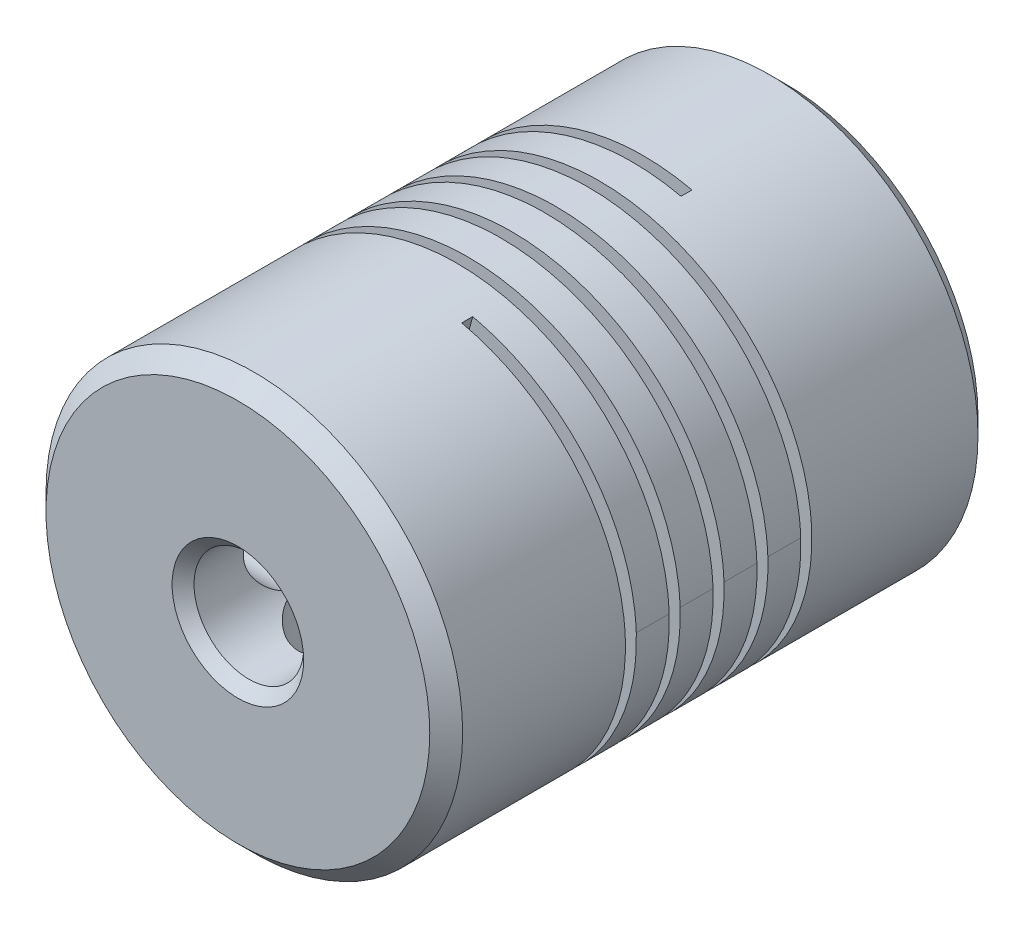
from build123d import *

# Parameters (mm, degrees)
SKETCH_1_R           = 9.5
BODY_DEPTH           = 25
SKETCH_2_R           = 2.5
RODHOLE_DEPTH        = 42
OUTERCHAMFER_SIZE    = 0.75
INNERCHAMFER_SIZE    = 0.5
SKETCH_3_R           = 1.75
SETSCREWHOLES1_DEPTH = 12
SKETCH_4_R           = 1.75
SETSCREWHOLES2_DEPTH = 12
SLOT_PITCH           = 2
SLOT_HEIGHT          = 10
SLOT_RADIUS          = 9.5
SLOT_START_ANGLE     = 105
SKETCH_7_W           = 0.5
SKETCH_7_H           = 8.647921781


with BuildPart() as part:
    # Эскиз1 → Body (new body)
    with BuildSketch(Plane.XY):
        Circle(SKETCH_1_R)
    extrude(amount=BODY_DEPTH)

    # Эскиз2 → RodHole (cut)
    with BuildSketch(Plane.XY.offset(25)):
        Circle(SKETCH_2_R)
    extrude(amount=-RODHOLE_DEPTH, mode=Mode.SUBTRACT)

    # OuterChamfer
    outerchamfer_edges = [part.edges().sort_by_distance(p)[0] for p in [
        (-9.5, 0, 0),
        (-9.5, 0, 25),
    ]]
    chamfer(outerchamfer_edges, length=OUTERCHAMFER_SIZE)

    # InnerChamfer
    innerchamfer_edges = [part.edges().sort_by_distance(p)[0] for p in [
        (-2.5, 0, 0),
        (-2.5, 0, 25),
    ]]
    chamfer(innerchamfer_edges, length=INNERCHAMFER_SIZE)

    # Эскиз3 → SetScrewHoles1 (cut)
    with BuildSketch(Plane(origin=(0, 0, 0), x_dir=(0, 0, -1), z_dir=(1, 0, 0))):
        with Locations((-4.5, 0)):
            Circle(SKETCH_3_R)
        with Locations((-20.5, 0)):
            Circle(SKETCH_3_R)
    extrude(amount=-SETSCREWHOLES1_DEPTH, mode=Mode.SUBTRACT)

    # Эскиз4 → SetScrewHoles2 (cut)
    with BuildSketch(Plane(origin=(0, 0, 0), x_dir=(1, 0, 0), z_dir=(0, 1, 0))):
        with Locations(Location((0, -4.5, 0), (0, 0, 270))):
            Circle(SKETCH_4_R)
        with Locations(Location((0, -20.5, 0), (0, 0, 270))):
            Circle(SKETCH_4_R)
    extrude(amount=-SETSCREWHOLES2_DEPTH, mode=Mode.SUBTRACT)

    # Slot: sweep along a helix
    with BuildLine() as slot_path:
        add(Helix(SLOT_PITCH, SLOT_HEIGHT, SLOT_RADIUS, center=(0, 0, 17), direction=(0, 0, -1), mode=Mode.PRIVATE).rotate(Axis((0, 0, 17), (0, 0, -1)), SLOT_START_ANGLE))
    # Эскиз7 → Slot (sweep, cut)
    with BuildSketch(Plane(origin=(0, 0, 0), x_dir=(0, 0, -1), z_dir=(0.9659258262890525, -0.25881904510257986, 0))):
        with Locations((-7, 5.755846261)):
            Rectangle(SKETCH_7_W, SKETCH_7_H)
    sweep(path=slot_path.line, is_frenet=True, mode=Mode.SUBTRACT)


solid = part.part
